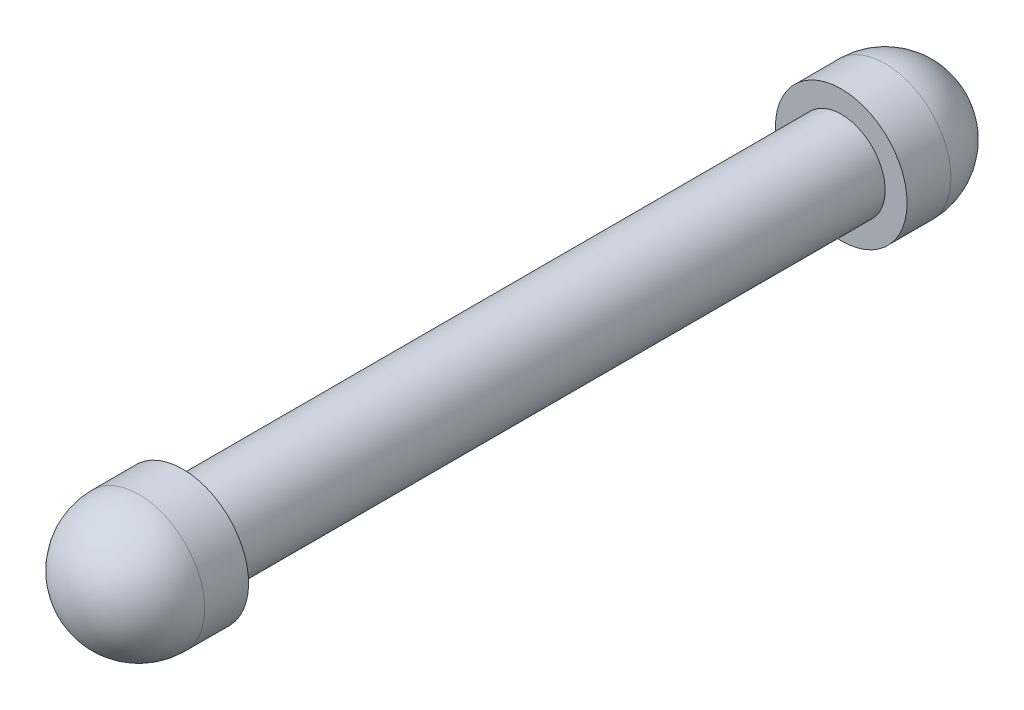
from build123d import *

# Parameters (mm, degrees)
SWEEP1_PROFILE_R     = 2
SKETCH11_R           = 3
BOSS_EXTRUDE1_DEPTH  = 5
FILLET2_R            = 3
FILLET2_OF_MIRROR1_R = 3


with BuildPart() as part:
    # Sweep1: sweep along a path in Sketch1
    with BuildLine(Plane(origin=(0, 0, 0), x_dir=(0, 0, -1), z_dir=(1, 0, 0))) as sweep1_path:
        Line((-14.999999972, 0), (14.999999972, 0))
    # Sweep1 profile (on start of the path) → Sweep1 (sweep)
    with BuildSketch(Plane(origin=(0, 0, 14.999999972), x_dir=(0, -1, 0), z_dir=(0, 0, -1))):
        Circle(SWEEP1_PROFILE_R)
    sweep(path=sweep1_path.line)

    # Sketch11 → Boss-Extrude1 (add)
    with BuildSketch(Plane(origin=(0, 0, -14.999999972), x_dir=(-1, 0, 0), z_dir=(0, 0, -1))):
        with Locations(Location((0, 0, 0), (0, 0, 90))):
            Circle(SKETCH11_R)
    boss_extrude1 = extrude(amount=BOSS_EXTRUDE1_DEPTH)

    # Fillet2
    fillet2_edges = [part.edges().sort_by_distance(p)[0] for p in [
        (0, -3, -19.999999972),
    ]]
    fillet(fillet2_edges, radius=FILLET2_R)

    # Mirror1: Boss-Extrude1 across plane
    add(boss_extrude1.mirror(Plane.XY))

    # Fillet2 of Mirror1
    fillet2_of_mirror1_edges = [part.edges().sort_by_distance(p)[0] for p in [
        (0, -3, 19.999999972),
    ]]
    fillet(fillet2_of_mirror1_edges, radius=FILLET2_OF_MIRROR1_R)


solid = part.part
